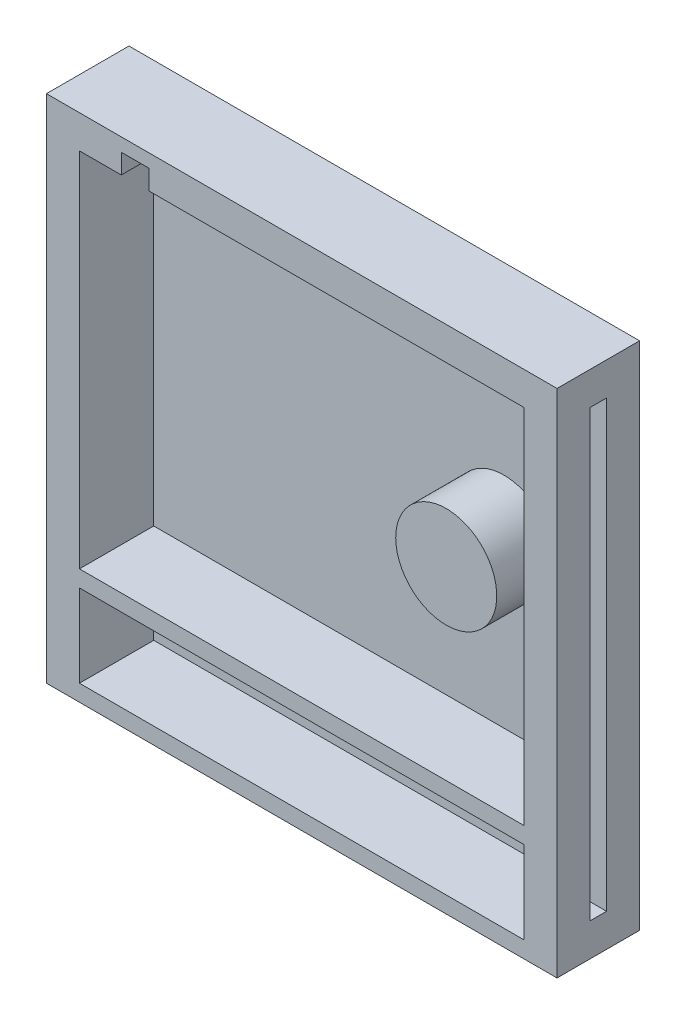
from build123d import *

# Parameters (mm, degrees)
SKETCH1_W           = 157.13579329
SKETCH1_H           = 157.13579329
BOSS_EXTRUDE1_DEPTH = 25.4
SKETCH2_W           = 136.81579329
SKETCH2_H           = 111.41579329
CUT_EXTRUDE1_DEPTH  = 22.86
SKETCH3_W           = 136.81579329
SKETCH3_H           = 25.4
CUT_EXTRUDE2_DEPTH  = 22.86
SKETCH5_W           = 5.08
SKETCH5_H           = 136.81579329
CUT_EXTRUDE3_DEPTH  = 7.62
SKETCH6_W           = 8.486375486
SKETCH6_H           = 6.062880986
CUT_EXTRUDE4_DEPTH  = 15.24
SKETCH8_R           = 15.547206761
BOSS_EXTRUDE3_DEPTH = 17.78


with BuildPart() as part:
    # Sketch1 → Boss-Extrude1 (new body)
    with BuildSketch(Plane.XY):
        Rectangle(SKETCH1_W, SKETCH1_H)
    extrude(amount=BOSS_EXTRUDE1_DEPTH)

    # Sketch2 → Cut-Extrude1 (cut)
    with BuildSketch(Plane.XY.offset(25.4)):
        with Locations((0, 12.7)):
            Rectangle(SKETCH2_W, SKETCH2_H)
    extrude(amount=-CUT_EXTRUDE1_DEPTH, mode=Mode.SUBTRACT)

    # Sketch3 → Cut-Extrude2 (cut)
    with BuildSketch(Plane.XY.offset(25.4)):
        with Locations((0, -60.787896645)):
            Rectangle(SKETCH3_W, SKETCH3_H)
    extrude(amount=-CUT_EXTRUDE2_DEPTH, mode=Mode.SUBTRACT)

    # Sketch5 → Cut-Extrude3 (cut)
    with BuildSketch(Plane.ZY.offset(78.567896645)):
        with Locations((12.7, 0)):
            Rectangle(SKETCH5_W, SKETCH5_H)
    cut_extrude3 = extrude(amount=-CUT_EXTRUDE3_DEPTH, mode=Mode.SUBTRACT)

    # Mirror1: Cut-Extrude3 across plane
    add(cut_extrude3.mirror(Plane(origin=(0, 0, 0), x_dir=(0, 0, 1), z_dir=(1, 0, 0))), mode=Mode.SUBTRACT)

    # Sketch6 → Cut-Extrude4 (cut)
    with BuildSketch(Plane.XY.offset(25.4)):
        with Locations((-51.293944562, 71.439337138)):
            Rectangle(SKETCH6_W, SKETCH6_H)
    extrude(amount=-CUT_EXTRUDE4_DEPTH, mode=Mode.SUBTRACT)

    # Sketch8 → Boss-Extrude3 (add)
    with BuildSketch(Plane.XY.offset(2.54)):
        with Locations(Location((39.391283746, 8.898945532, 0), (0, 0, 180))):
            Circle(SKETCH8_R)
    extrude(amount=BOSS_EXTRUDE3_DEPTH)


solid = part.part
